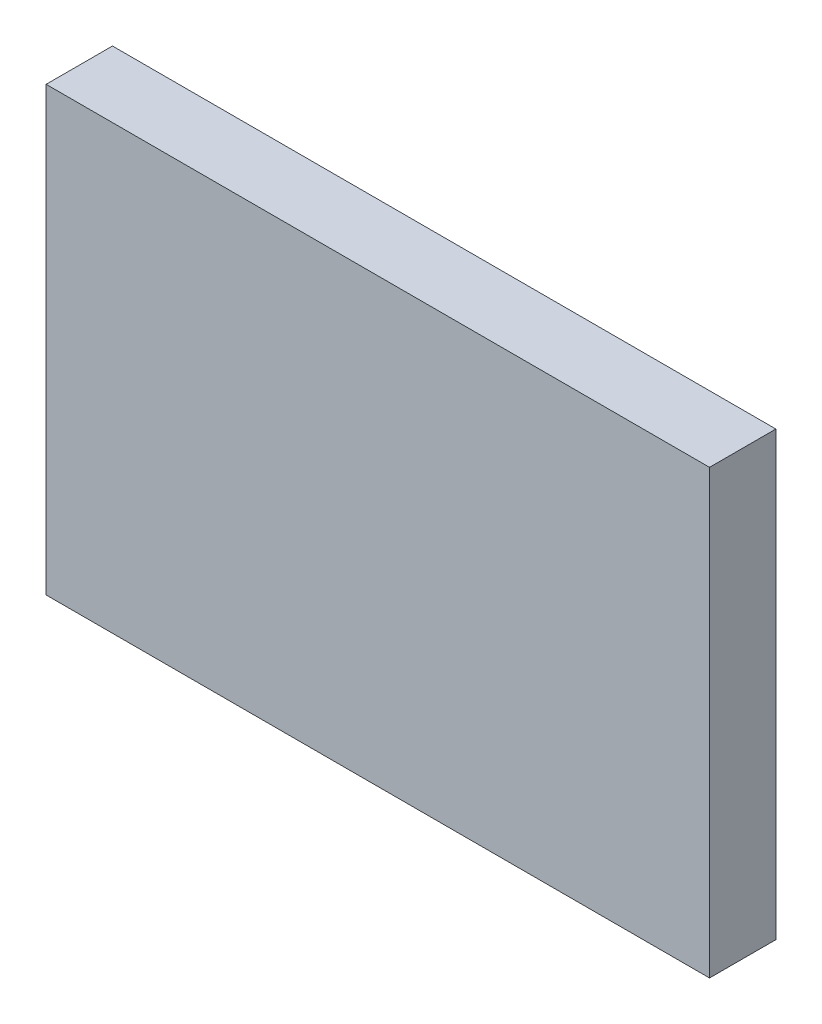
from build123d import *

# Parameters (mm, degrees)
SKETCH1_W           = 30
SKETCH1_H           = 20
BOSS_EXTRUDE1_DEPTH = 3


with BuildPart() as part:
    # Sketch1 → Boss-Extrude1 (new body)
    with BuildSketch(Plane.XY):
        with Locations((15, 10)):
            Rectangle(SKETCH1_W, SKETCH1_H)
    extrude(amount=BOSS_EXTRUDE1_DEPTH)


solid = part.part
